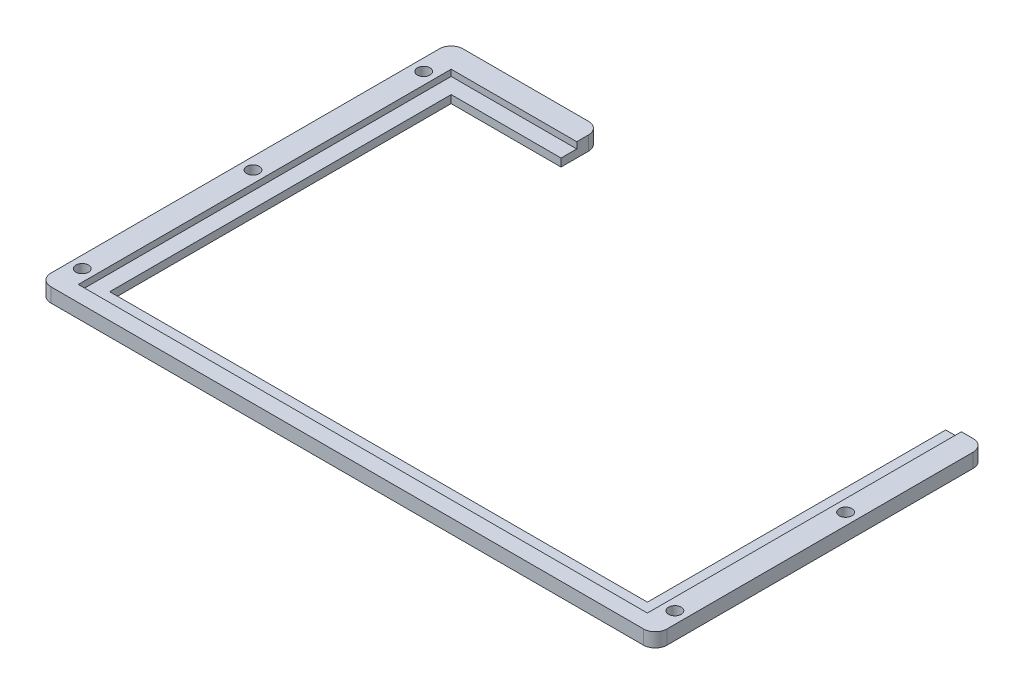
from build123d import *

# Parameters (mm, degrees)
BOSS_EXTRUDE1_DEPTH = 3.175
BOSS_EXTRUDE2_DEPTH = 2.54
SKETCH3_R           = 2.5527
CUT_EXTRUDE1_DEPTH  = 153.360472739


with BuildPart() as part:
    # Sketch1 → Boss-Extrude1 (new body)
    with BuildSketch(Plane(origin=(0, 0, 0), x_dir=(1, 0, 0), z_dir=(0, 1, 0))):
        with BuildLine():
            Line((-64.29375, 80.16875), (-64.29375, 69.05625))
            Line((-64.29375, 69.05625), (-108.74375, 69.05625))
            Line((-108.74375, 69.05625), (-108.74375, -69.05625))
            Line((-108.74375, -69.05625), (108.74375, -69.05625))
            Line((108.74375, -69.05625), (108.74375, 51.59375))
            Line((108.74375, 51.59375), (119.85625, 51.59375))
            ThreePointArc((119.85625, 51.59375), (123.223846045, 50.198846045), (124.61875, 46.83125))
            Line((124.61875, 46.83125), (124.61875, -76.99375))
            ThreePointArc((124.61875, -76.99375), (123.223846045, -80.361346045), (119.85625, -81.75625))
            Line((119.85625, -81.75625), (-119.85625, -81.75625))
            ThreePointArc((-119.85625, -81.75625), (-123.223846045, -80.361346045), (-124.61875, -76.99375))
            Line((-124.61875, -76.99375), (-124.61875, 80.16875))
            ThreePointArc((-124.61875, 80.16875), (-123.223846045, 83.536346045), (-119.85625, 84.93125))
            Line((-119.85625, 84.93125), (-69.05625, 84.93125))
            ThreePointArc((-69.05625, 84.93125), (-65.688653955, 83.536346045), (-64.29375, 80.16875))
        make_face()
    extrude(amount=BOSS_EXTRUDE1_DEPTH)

    # Sketch2 → Boss-Extrude2 (add)
    with BuildSketch(Plane(origin=(0, 3.175, 0), x_dir=(1, 0, 0), z_dir=(0, 1, 0))):
        with BuildLine():
            Line((-64.29375, 80.16875), (-64.29375, 75.40625))
            Line((-64.29375, 75.40625), (-115.09375, 75.40625))
            Line((-115.09375, 75.40625), (-115.09375, -75.40625))
            Line((-115.09375, -75.40625), (115.09375, -75.40625))
            Line((115.09375, -75.40625), (115.09375, 51.59375))
            Line((115.09375, 51.59375), (119.85625, 51.59375))
            ThreePointArc((119.85625, 51.59375), (123.223846045, 50.198846045), (124.61875, 46.83125))
            Line((124.61875, 46.83125), (124.61875, -76.99375))
            ThreePointArc((124.61875, -76.99375), (123.223846045, -80.361346045), (119.85625, -81.75625))
            Line((119.85625, -81.75625), (-119.85625, -81.75625))
            ThreePointArc((-119.85625, -81.75625), (-123.223846045, -80.361346045), (-124.61875, -76.99375))
            Line((-124.61875, -76.99375), (-124.61875, 80.16875))
            ThreePointArc((-124.61875, 80.16875), (-123.223846045, 83.536346045), (-119.85625, 84.93125))
            Line((-119.85625, 84.93125), (-69.05625, 84.93125))
            ThreePointArc((-69.05625, 84.93125), (-65.688653955, 83.536346045), (-64.29375, 80.16875))
        make_face()
    extrude(amount=BOSS_EXTRUDE2_DEPTH)

    # Sketch3 → Cut-Extrude1 (cut, through all)
    with BuildSketch(Plane(origin=(0, 5.715, -5.715), x_dir=(-1, 0, 0), z_dir=(0, 1, 0))):
        with Locations(Location((119.85625, -63.34125, 0), (0, 0, 90))):
            Circle(SKETCH3_R)
        with Locations(Location((119.85625, 74.77125, 0), (0, 0, 90))):
            Circle(SKETCH3_R)
        with Locations(Location((119.85625, 5.715, 0), (0, 0, 90))):
            Circle(SKETCH3_R)
        with Locations(Location((-119.85625, 74.77125, 0), (0, 0, 90))):
            Circle(SKETCH3_R)
        with Locations(Location((-119.85625, 5.715, 0), (0, 0, 90))):
            Circle(SKETCH3_R)
    extrude(amount=-CUT_EXTRUDE1_DEPTH, mode=Mode.SUBTRACT)


solid = part.part
